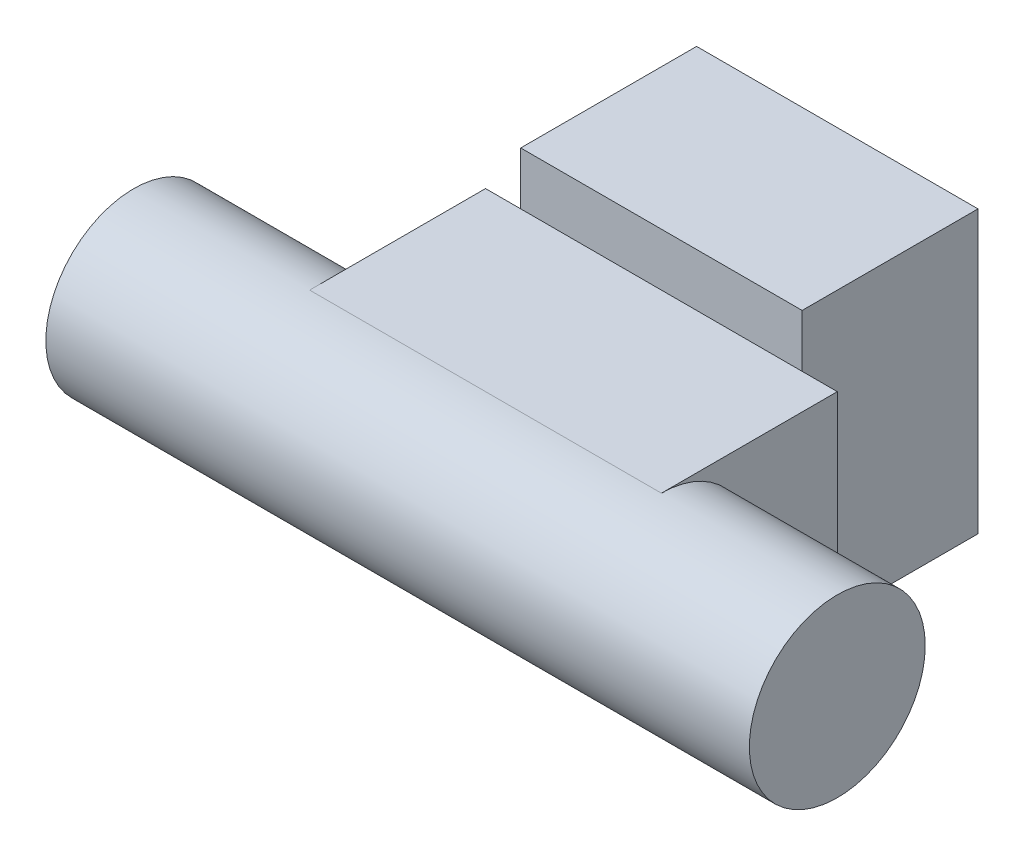
from build123d import *

# Parameters (mm, degrees)
SKETCH2_W           = 10
SKETCH2_H           = 10
BOSS_EXTRUDE1_DEPTH = 10
SKETCH3_R           = 5
BOSS_EXTRUDE2_DEPTH = 20
SKETCH4_W           = 16
SKETCH4_H           = 16
BOSS_EXTRUDE3_DEPTH = 10
SKETCH5_R           = 5
CUT_EXTRUDE1_DEPTH  = 4
SKETCH6_R           = 7
CUT_EXTRUDE2_DEPTH  = 4


with BuildPart() as part:
    # Sketch2 → Boss-Extrude1 (new body)
    with BuildSketch(Plane.XY):
        with Locations((5, -5)):
            Rectangle(SKETCH2_W, SKETCH2_H)
    boss_extrude1 = extrude(amount=BOSS_EXTRUDE1_DEPTH)

    # Sketch3 → Boss-Extrude2 (add)
    with BuildSketch(Plane(origin=(0, 0, 0), x_dir=(0, 0, -1), z_dir=(1, 0, 0))):
        with Locations(Location((-10, -5, 0), (0, 0, 90))):
            Circle(SKETCH3_R)
    boss_extrude2 = extrude(amount=BOSS_EXTRUDE2_DEPTH)

    # Mirror1: Boss-Extrude1, Boss-Extrude2 across plane
    add(boss_extrude1.mirror(Plane(origin=(0, 0, 10), x_dir=(0, 0, 1), z_dir=(1, 0, 0))))
    add(boss_extrude2.mirror(Plane(origin=(0, 0, 10), x_dir=(0, 0, 1), z_dir=(1, 0, 0))))

    # Sketch4 → Boss-Extrude3 (add)
    with BuildSketch(Plane(origin=(0, 0, 0), x_dir=(-1, 0, 0), z_dir=(0, 0, -1))):
        with Locations((0, -5)):
            Rectangle(SKETCH4_W, SKETCH4_H)
    extrude(amount=BOSS_EXTRUDE3_DEPTH)

    # Sketch5 → Cut-Extrude1 (cut)
    with BuildSketch(Plane(origin=(0, 0, -10), x_dir=(-1, 0, 0), z_dir=(0, 0, -1))):
        with Locations((0, -5)):
            Circle(SKETCH5_R)
    extrude(amount=-CUT_EXTRUDE1_DEPTH, mode=Mode.SUBTRACT)

    # Sketch6 → Cut-Extrude2 (cut)
    with BuildSketch(Plane(origin=(0, 0, -6), x_dir=(-1, 0, 0), z_dir=(0, 0, -1))):
        with Locations((0, -5)):
            Circle(SKETCH6_R)
    extrude(amount=-CUT_EXTRUDE2_DEPTH, mode=Mode.SUBTRACT)


solid = part.part
